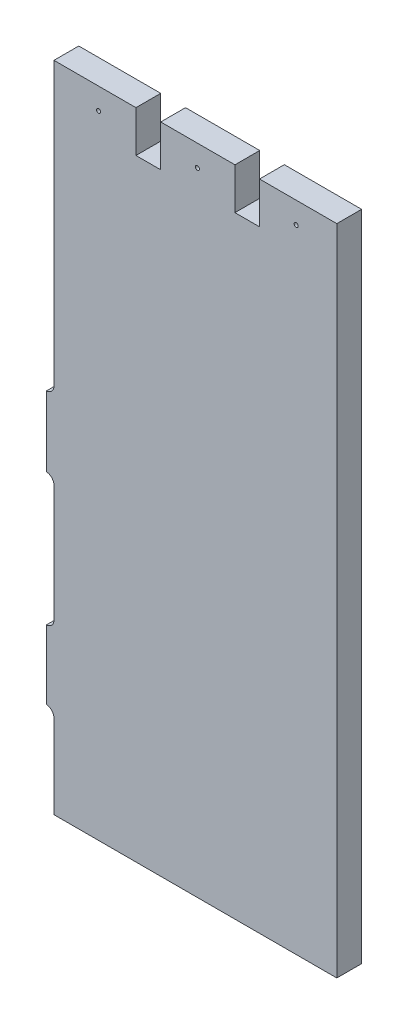
from build123d import *

# Parameters (mm, degrees)
ESQUISSE1_R             = 0.127
ESQUISSE1_R_2           = 0.3999992
ESQUISSE1_R_3           = 0.4953
BOSS_EXTRU_1_DEPTH      = 1.55632912
ESQUISSE2_W             = 12.774737624
ESQUISSE2_H             = 41
ENL_V_MAT_EXTRU_1_DEPTH = 52.423945398


with BuildPart() as part:
    # Esquisse1 → Boss.-Extru.1 (new body)
    with BuildSketch(Plane(origin=(0, 0, 0), x_dir=(-1, 0, 0), z_dir=(0, 0, -1))):
        with BuildLine():
            Line((-12.23900032, 5.25), (-12.23900032, 0))
            Line((-12.23900032, 0), (0, 0))
            Line((0, 0), (0, 41))
            Line((0, 41), (-12.23900032, 41))
            Line((-12.23900032, 41), (-12.23900032, 23.299999237))
            ThreePointArc((-12.23900032, 23.299999237), (-12.74450016, 22.794499397), (-13.25, 23.299999237))
            Line((-13.25, 23.299999237), (-13.25, 41))
            Line((-13.25, 41), (-18.3939991, 41))
            Line((-18.3939991, 41), (-18.3939991, 38.400001526))
            Line((-18.3939991, 38.400001526), (-19.950000763, 38.400001526))
            Line((-19.950000763, 38.400001526), (-19.950000763, 41))
            Line((-19.950000763, 41), (-24.607000351, 41))
            Line((-24.607000351, 41), (-24.607000351, 38.400001526))
            Line((-24.607000351, 38.400001526), (-26.149999619, 38.400001526))
            Line((-26.149999619, 38.400001526), (-26.149999619, 41))
            Line((-26.149999619, 41), (-31, 41))
            Line((-31, 41), (-31, 0))
            Line((-31, 0), (-13.25, 0))
            Line((-13.25, 0), (-13.25, 5.25))
            ThreePointArc((-13.25, 5.25), (-12.74450016, 5.756000289), (-12.23900032, 5.25))
        make_face()
        with Locations(Location((-22.24999868, 39.64999944, 0), (0, 0, 180))):
            Circle(ESQUISSE1_R, mode=Mode.SUBTRACT)
        with Locations(Location((-28.44999898, 39.64999944, 0), (0, 0, 180))):
            Circle(ESQUISSE1_R, mode=Mode.SUBTRACT)
        with Locations(Location((-16.04999838, 39.64999944, 0), (0, 0, 180))):
            Circle(ESQUISSE1_R, mode=Mode.SUBTRACT)
        with Locations(Location((-8.7900002, 35.81500076, 0), (0, 0, 180))):
            Circle(ESQUISSE1_R_2, mode=Mode.SUBTRACT)
        with Locations(Location((-6.2500002, 38.35500076, 0), (0, 0, 180))):
            Circle(ESQUISSE1_R_2, mode=Mode.SUBTRACT)
        with Locations(Location((-3.7100002, 35.81500076, 0), (0, 0, 180))):
            Circle(ESQUISSE1_R_2, mode=Mode.SUBTRACT)
        with Locations(Location((-3.59000044, 6.14000042, 0), (0, 0, 180))):
            Circle(ESQUISSE1_R_3, mode=Mode.SUBTRACT)
        with Locations(Location((-1.05000044, 6.14000042, 0), (0, 0, 180))):
            Circle(ESQUISSE1_R_3, mode=Mode.SUBTRACT)
        with Locations(Location((-1.05000044, 1.06000042, 0), (0, 0, 180))):
            Circle(ESQUISSE1_R_3, mode=Mode.SUBTRACT)
        with Locations(Location((-1.05000044, 3.60000042, 0), (0, 0, 180))):
            Circle(ESQUISSE1_R_3, mode=Mode.SUBTRACT)
        with BuildLine():
            Line((-12.250000009, 17.899931304), (-12.251000404, 10.578000069))
            ThreePointArc((-12.251000404, 10.578000069), (-12.761750957, 10.078121146), (-13.25, 10.600000381))
            Line((-13.25, 10.600000381), (-13.25, 17.899999619))
            ThreePointArc((-13.25, 17.899999619), (-12.749965845, 18.399999615), (-12.250000009, 17.899931304))
        make_face(mode=Mode.SUBTRACT)
    extrude(amount=-BOSS_EXTRU_1_DEPTH)

    # Esquisse2 → Enlèv. mat.-Extru.1 (cut, through all)
    with BuildSketch(Plane.XY.offset(1.55632912)):
        with Locations((6.387368812, 20.5)):
            Rectangle(ESQUISSE2_W, ESQUISSE2_H)
    extrude(amount=-ENL_V_MAT_EXTRU_1_DEPTH, mode=Mode.SUBTRACT)


solid = part.part
